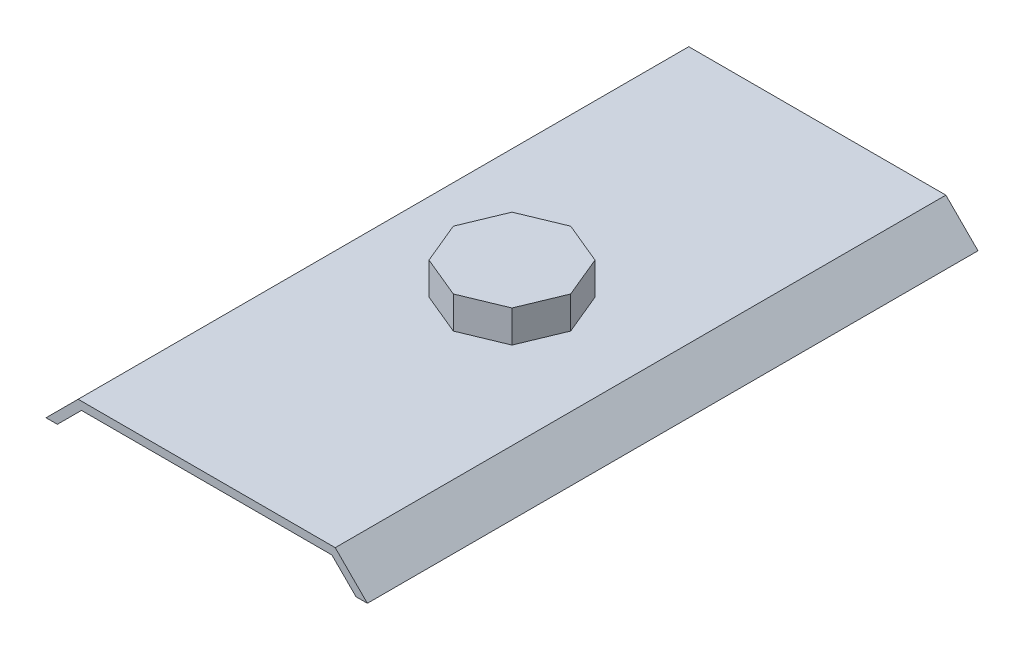
from build123d import *

# Parameters (mm, degrees)
BOSS_EXTRUDE4_DEPTH = 965.2
SKETCH61_R          = 50.8
SKETCH61_R_2        = 25.4
BOSS_EXTRUDE5_DEPTH = 50.8
BOSS_EXTRUDE6_DEPTH = 50.8


with BuildPart() as part:
    # Sketch1 → Boss-Extrude4 (new body)
    with BuildSketch(Plane.XY):
        Polygon((-203.2, 25.4), (-254, -25.4), (-236.039487758, -25.4), (-223.339487758, -12.7), (-197.939487758, 12.7), (-185.239487758, 25.4), align=None)
        Polygon((203.2, 25.4), (-185.239487758, 25.4), (-197.939487758, 12.7), (197.939487758, 12.7), (223.339487758, -12.7), (236.039487758, -25.4), (254, -25.4), align=None)
    extrude(amount=BOSS_EXTRUDE4_DEPTH)


with BuildPart() as part_1:
    # Body-Move/Copy1: moved
    add(part.part.moved(Location((0, 0, -482.6))))

    # Sketch61 → Boss-Extrude5 (add)
    # profile 1 of 4: a face of its own
    with BuildSketch(Plane.XZ.offset(-12.7)):
        with Locations((-145.808181247, 254)):
            Circle(SKETCH61_R)
        with Locations(Location((-145.808181247, 254, 0), (0, 0, 180))):
            Circle(SKETCH61_R_2, mode=Mode.SUBTRACT)
    # profile 2 of 4: a face of its own
    with BuildSketch(Plane.XZ.offset(-12.7)):
        with Locations(Location((145.808181247, 254, 0), (0, 0, 180))):
            Circle(SKETCH61_R)
        with Locations((145.808181247, 254)):
            Circle(SKETCH61_R_2, mode=Mode.SUBTRACT)
    # profile 3 of 4: a face of its own
    with BuildSketch(Plane.XZ.offset(-12.7)):
        with Locations((145.808181247, -254)):
            Circle(SKETCH61_R)
        with Locations(Location((145.808181247, -254, 0), (0, 0, 180))):
            Circle(SKETCH61_R_2, mode=Mode.SUBTRACT)
    # profile 4 of 4: a face of its own
    with BuildSketch(Plane.XZ.offset(-12.7)):
        with Locations(Location((-145.808181247, -254, 0), (0, 0, 180))):
            Circle(SKETCH61_R)
        with Locations((-145.808181247, -254)):
            Circle(SKETCH61_R_2, mode=Mode.SUBTRACT)
    extrude(amount=BOSS_EXTRUDE5_DEPTH)

    # Sketch62 → Boss-Extrude6 (add)
    with BuildSketch(Plane(origin=(0, 25.4, 0), x_dir=(1, 0, 0), z_dir=(0, 1, 0))):
        Polygon((0, -92.772173632), (65.599833081, -65.599833081), (92.772173632, 0), (65.599833081, 65.599833081), (0, 92.772173632), (-65.599833081, 65.599833081), (-92.772173632, 0), (-65.599833081, -65.599833081), align=None)
    extrude(amount=BOSS_EXTRUDE6_DEPTH)


solid = part_1.part
